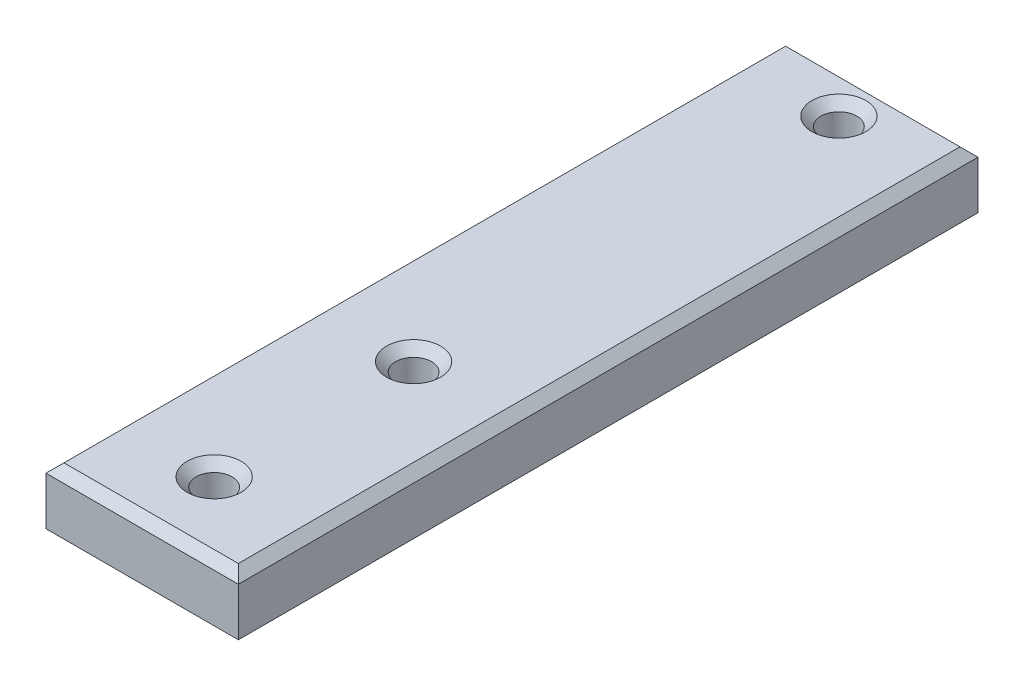
from build123d import *

# Parameters (mm, degrees)
SKETCH1_W           = 21.384482042
SKETCH1_H           = 82.225
SKETCH1_R           = 2
BOSS_EXTRUDE1_DEPTH = 6.35
CHAMFER1_SIZE       = 1


with BuildPart() as part:
    # Sketch1 → Boss-Extrude1 (new body)
    with BuildSketch(Plane(origin=(0, 0, 0), x_dir=(1, 0, 0), z_dir=(0, 1, 0))):
        with Locations((0, 6.1625)):
            Rectangle(SKETCH1_W, SKETCH1_H)
        with Locations(Location((0, 42.5, 0), (0, 0, 270))):
            Circle(SKETCH1_R, mode=Mode.SUBTRACT)
        with Locations(Location((0, -4.775, 0), (0, 0, 90))):
            Circle(SKETCH1_R, mode=Mode.SUBTRACT)
        with Locations(Location((0, -26.95, 0), (0, 0, 270))):
            Circle(SKETCH1_R, mode=Mode.SUBTRACT)
    extrude(amount=BOSS_EXTRUDE1_DEPTH)

    # Chamfer1
    chamfer1_edges = [part.edges().sort_by_distance(p)[0] for p in [
        (0, 6.35, -44.5),
        (0, 6.35, 34.95),
        (0, 6.35, 6.775),
        (10.692241021, 6.35, -6.1625),
        (0, 6.35, 24.95),
        (0, 6.35, -47.275),
        (-10.692241021, 6.35, -6.1625),
    ]]
    chamfer(chamfer1_edges, length=CHAMFER1_SIZE)


solid = part.part
